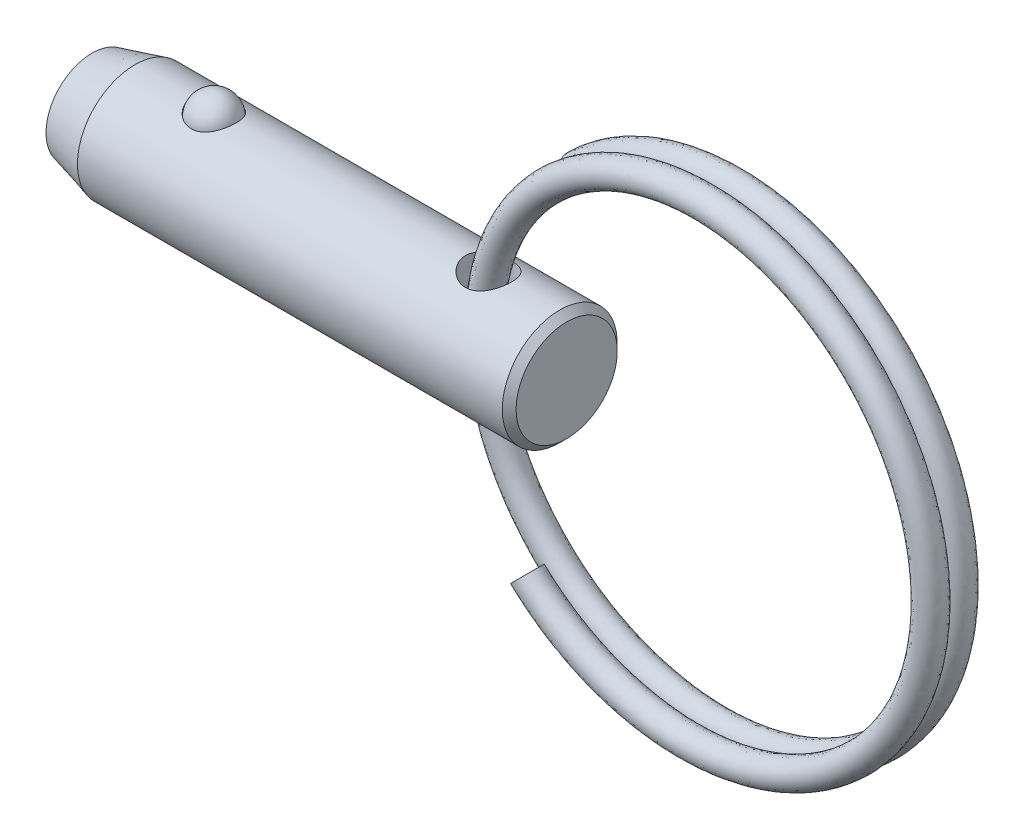
from build123d import *

# Parameters (mm, degrees)
SKETCH4_W          = 1.27
SKETCH4_H          = 6.35
SWEEP1_PITCH       = 1.5494
SWEEP1_HEIGHT      = 1.355725
SWEEP1_RADIUS      = 13.462
SKETCH6_R          = 0.762
SWEEP2_PITCH       = 1.5494
SWEEP2_HEIGHT      = 1.355725
SWEEP2_RADIUS      = 13.462
SWEEP2_START_ANGLE = -180
SKETCH6_2_R        = 0.762


with BuildPart() as part:
    # Sketch1 → Revolve1 (revolve)
    with BuildSketch(Plane.XY, mode=Mode.PRIVATE) as revolve1_sk:
        Polygon((13.1064, 2.794), (12.7254, 3.175), (-10.736547737, 3.175), (-13.1064, 2.54), (-13.1064, 0), (13.1064, 0), align=None)
    revolve(revolve1_sk.sketch.rotate(Axis((13.1064, 0, 0), (1, 0, 0)), 90), axis=Axis((13.1064, 0, 0), (1, 0, 0)))

    # Sketch2 → Cut-Revolve1 (revolve, cut)
    with BuildSketch(Plane.XY):
        with BuildLine():
            Line((-5.114582051, 2.8575), (-7.629182051, 2.8575))
            ThreePointArc((-7.629182051, 2.8575), (-6.371882051, 4.1148), (-5.114582051, 2.8575))
        make_face()
    revolve(axis=Axis((-5.114582051, 2.8575, 0), (1, 0, 0)), mode=Mode.SUBTRACT)

    # Sketch4 → Cut-Revolve2 (revolve, cut)
    with BuildSketch(Plane.XY, mode=Mode.PRIVATE) as cut_revolve2_sk:
        with Locations((9.4234, 0)):
            Rectangle(SKETCH4_W, SKETCH4_H)
    revolve(cut_revolve2_sk.sketch.rotate(Axis((8.7884, -3.175, 0), (0, 1, 0)), 90), axis=Axis((8.7884, -3.175, 0), (0, 1, 0)), mode=Mode.SUBTRACT)


with BuildPart() as body_2:
    # Sketch3 → Revolve2 (revolve)
    with BuildSketch(Plane.XY):
        with BuildLine():
            Line((-5.139982051, 2.8575), (-7.603782051, 2.8575))
            ThreePointArc((-7.603782051, 2.8575), (-6.371882051, 4.0894), (-5.139982051, 2.8575))
        make_face()
    revolve(axis=Axis((-5.139982051, 2.8575, 0), (1, 0, 0)))


with BuildPart() as body_3:
    # Sweep1: sweep along a helix
    with BuildLine() as sweep1_path:
        Helix(SWEEP1_PITCH, SWEEP1_HEIGHT, SWEEP1_RADIUS, center=(21.273425091, 0, 0), direction=(0, 0, -1), lefthand=True)
    # Sketch6 → Sweep1 (sweep)
    with BuildSketch(Plane(origin=(114.003847968, 0, 0), x_dir=(0, 0, -1), z_dir=(0, 1, 0))):
        with Locations((0, 105.430422877)):
            Circle(SKETCH6_R)
    sweep(path=sweep1_path.line, is_frenet=True)

    # Sweep2: sweep along a helix
    with BuildLine() as sweep2_path:
        add(Helix(SWEEP2_PITCH, SWEEP2_HEIGHT, SWEEP2_RADIUS, center=(21.273425091, 0, 0), direction=(0, 0, 1), lefthand=True, mode=Mode.PRIVATE).rotate(Axis((21.273425091, 0, 0), (0, 0, 1)), SWEEP2_START_ANGLE))
    # Sketch6<2> → Sweep2 (sweep)
    with BuildSketch(Plane(origin=(114.003847968, 0, 0), x_dir=(0, 0, -1), z_dir=(0, 1, 0))):
        with Locations((0, 105.430422877)):
            Circle(SKETCH6_2_R)
    sweep(path=sweep2_path.line, is_frenet=True)


solid = Compound([part.part, body_2.part, body_3.part])
